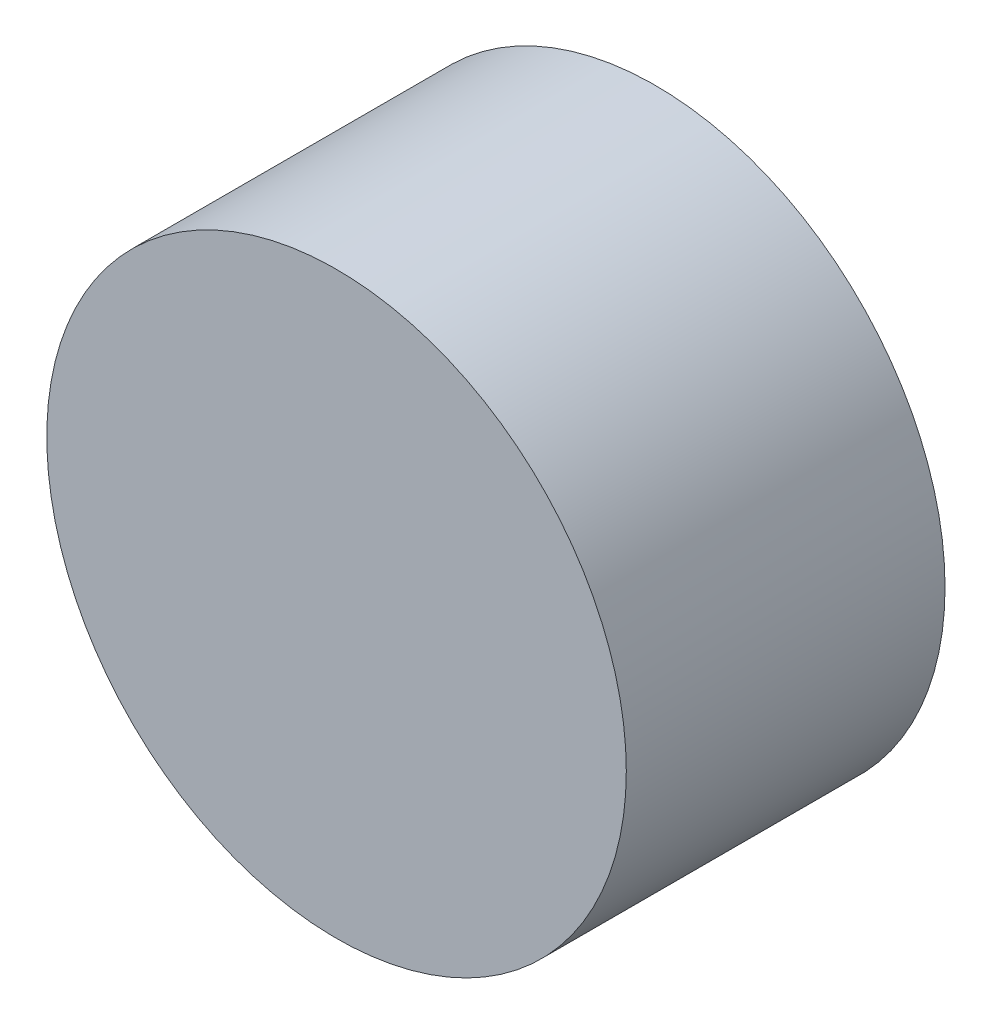
from build123d import *

# Parameters (mm, degrees)
SKETCH1_R           = 5
BOSS_EXTRUDE1_DEPTH = 5.5


with BuildPart() as part:
    # Sketch1 → Boss-Extrude1 (new body)
    with BuildSketch(Plane.XY):
        Circle(SKETCH1_R)
    extrude(amount=BOSS_EXTRUDE1_DEPTH)


solid = part.part
